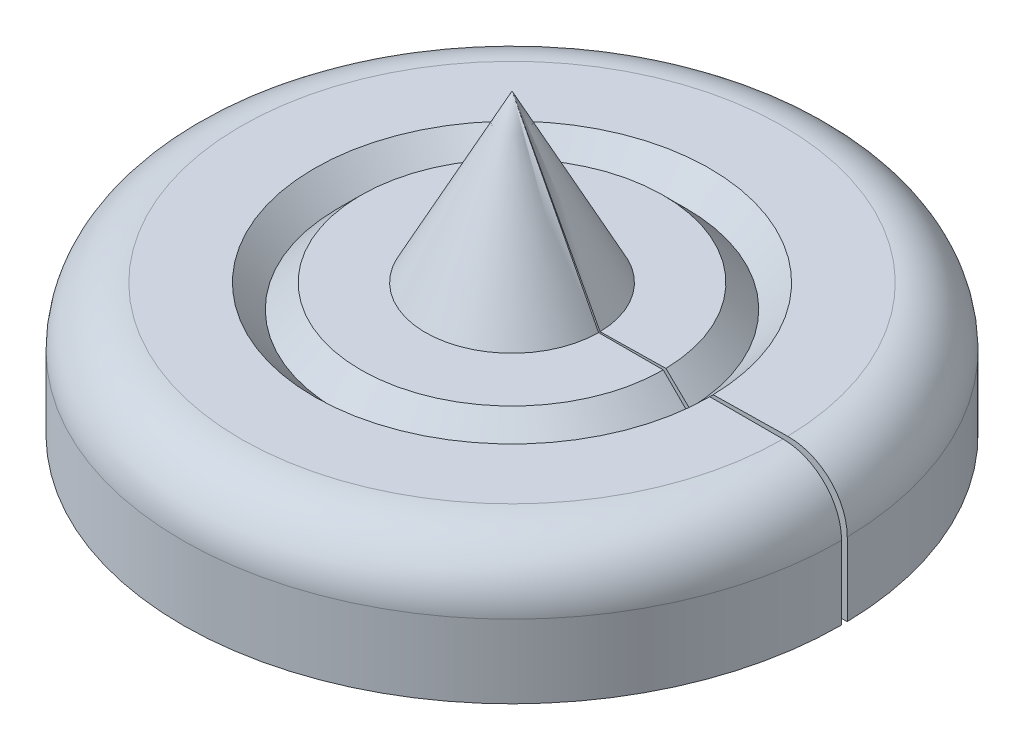
from build123d import *

# Parameters (mm, degrees)
REVOLVE3_ANGLE = 359


with BuildPart() as part:
    # Sketch1 → Revolve3 (revolve)
    with BuildSketch(Plane.XY):
        with BuildLine():
            Line((25.4, 0), (0, 25.4))
            Line((0, 25.4), (0, 114.740562784))
            Line((0, 114.740562784), (33.369066404, 50.8))
            Line((33.369066404, 50.8), (58.29289998, 50.8))
            Line((58.29289998, 50.8), (67.24644999, 41.84644999))
            Line((67.24644999, 41.84644999), (76.2, 50.8))
            Line((76.2, 50.8), (104.441096188, 50.8))
            ThreePointArc((104.441096188, 50.8), (120.39265005, 44.19265005), (127, 28.241096188))
            Line((127, 28.241096188), (127, 0))
            Line((127, 0), (25.4, 0))
        make_face()
    revolve(axis=Axis((0, 25.4, 0), (0, -1, 0)), revolution_arc=REVOLVE3_ANGLE)


solid = part.part
